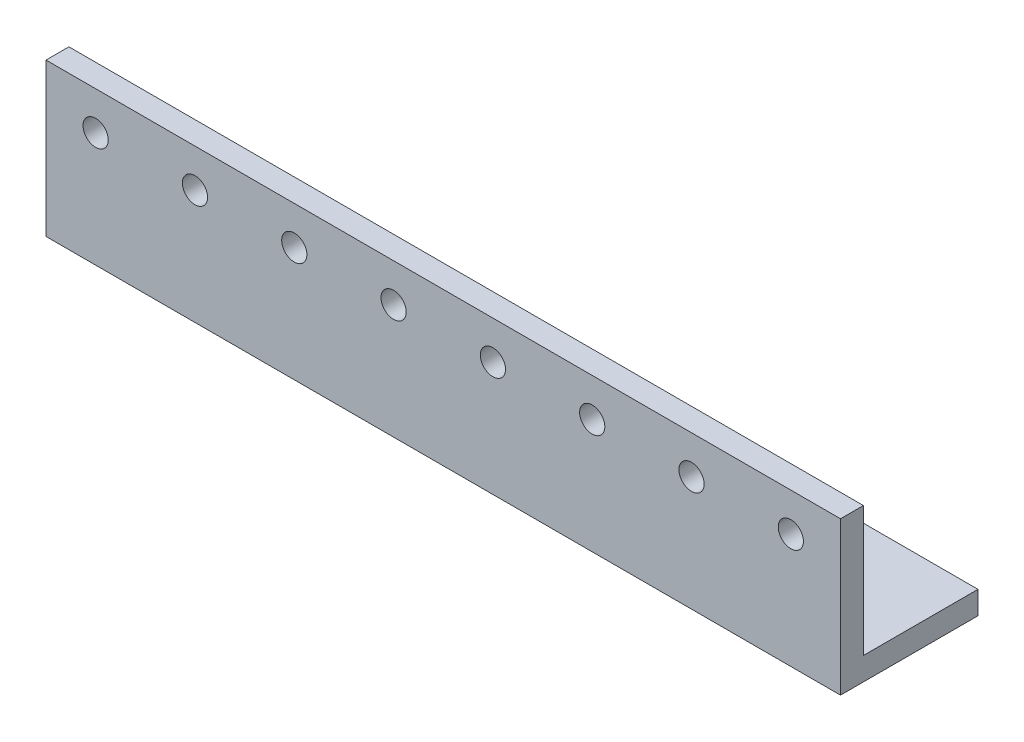
from build123d import *

# Parameters (mm, degrees)
SKETCH2_W                                  = 104
SKETCH2_H                                  = 20
BOSS_EXTRUDE1_DEPTH                        = 3
M4X0_7_TAPPED_HOLE1_D                      = 3.3
SKETCH5_W                                  = 104
SKETCH5_H                                  = 3
BOSS_EXTRUDE2_DEPTH                        = 15
CSK_FOR_10_FLAT_HEAD_MACHINE_SCREW_2_COUNT = 2
CSK_FOR_10_FLAT_HEAD_MACHINE_SCREW_2_PITCH = 37.5
CSK_FOR_10_FLAT_HEAD_MACHINE_SCREW_3_COUNT = 2
CSK_FOR_10_FLAT_HEAD_MACHINE_SCREW_3_PITCH = 75


with BuildPart() as part:
    # Sketch2 → Boss-Extrude1 (new body)
    with BuildSketch(Plane.XY):
        with Locations((0, -10)):
            Rectangle(SKETCH2_W, SKETCH2_H)
    extrude(amount=BOSS_EXTRUDE1_DEPTH)

    # M4x0.7 Tapped Hole1 (through all)
    with Locations(Plane.XY.offset(3)):
        with Locations((-45.5, -5), (45.5, -5), (-32.5, -5), (-19.5, -5), (-6.5, -5), (6.5, -5), (19.5, -5), (32.5, -5)):
            Hole(M4X0_7_TAPPED_HOLE1_D / 2)

    # Sketch5 → Boss-Extrude2 (add)
    with BuildSketch(Plane(origin=(0, 0, 0), x_dir=(-1, 0, 0), z_dir=(0, 0, -1))):
        with Locations((0, -18.5)):
            Rectangle(SKETCH5_W, SKETCH5_H)
    extrude(amount=BOSS_EXTRUDE2_DEPTH)

    # Sketch7 → CSK for #10 Flat Head Machine Screw (100)1 (revolve, cut)
    with BuildSketch(Plane(origin=(37.5, -17, -7.5), x_dir=(0, 0, 1), z_dir=(1, 0, 0))):
        Polygon((0, 0), (0, 3), (2.5527, 3), (2.5527, 1.960808018), (4.8895, 0), align=None)
    csk_for_10_flat_head_machine_screw_100 = revolve(axis=Axis((37.5, -10.65, -7.5), (0, -1, 0)), mode=Mode.SUBTRACT)

    # CSK for _10 Flat Head Machine Screw  2: CSK for #10 Flat Head Machine Screw (100)1 ×2
    with Locations(*[(-i * CSK_FOR_10_FLAT_HEAD_MACHINE_SCREW_2_PITCH, 0, 0) for i in range(1, CSK_FOR_10_FLAT_HEAD_MACHINE_SCREW_2_COUNT)]):
        add(csk_for_10_flat_head_machine_screw_100, mode=Mode.SUBTRACT)

    # CSK for _10 Flat Head Machine Screw  3: CSK for #10 Flat Head Machine Screw (100)1 ×2
    with Locations(*[(-i * CSK_FOR_10_FLAT_HEAD_MACHINE_SCREW_3_PITCH, 0, 0) for i in range(1, CSK_FOR_10_FLAT_HEAD_MACHINE_SCREW_3_COUNT)]):
        add(csk_for_10_flat_head_machine_screw_100, mode=Mode.SUBTRACT)


solid = part.part
